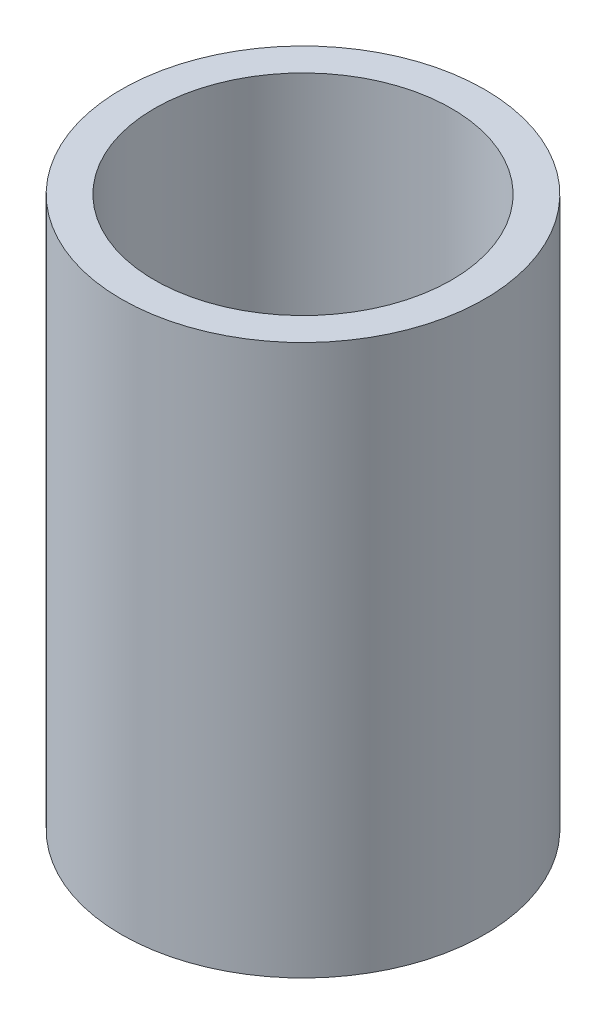
from build123d import *

# Parameters (mm, degrees)
SKETCH1_R           = 16.5
SKETCH1_R_2         = 13.5
EXTRUDE_THIN1_DEPTH = 25


with BuildPart() as part:
    # Sketch1 → Extrude-Thin1 (new, symmetric)
    with BuildSketch(Plane(origin=(0, 0, 0), x_dir=(1, 0, 0), z_dir=(0, 1, 0))):
        Circle(SKETCH1_R)
        Circle(SKETCH1_R_2, mode=Mode.SUBTRACT)
    extrude(amount=EXTRUDE_THIN1_DEPTH, both=True)


solid = part.part
